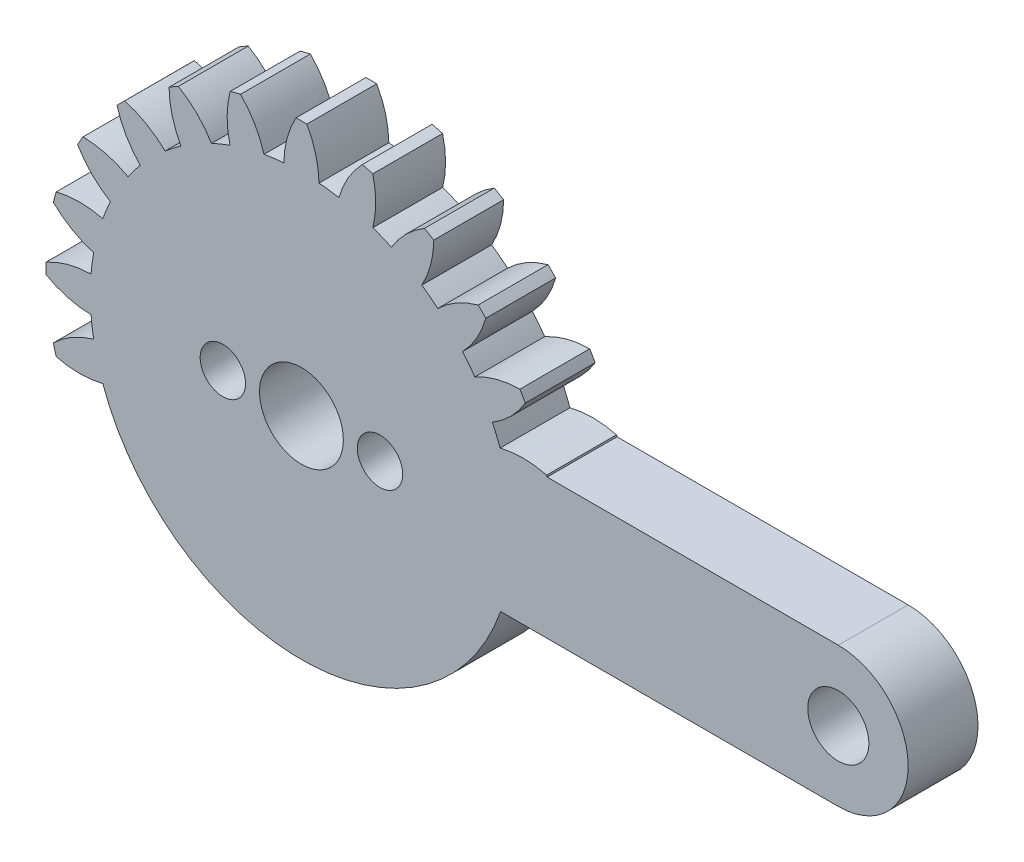
from build123d import *

# Parameters (mm, degrees)
SKETCH1_R           = 1.75
BOSS_EXTRUDE1_DEPTH = 4
SKETCH2_R           = 1.3
SKETCH2_R_2         = 2.4
CUT_EXTRUDE1_DEPTH  = 38.915688046


with BuildPart() as part:
    # Sketch1 → Boss-Extrude1 (new body)
    with BuildSketch(Plane.XY):
        with BuildLine():
            ThreePointArc((30.75, -4), (34.75, 0), (30.75, 4))
            Line((30.75, 4), (14.072558403, 4))
            ThreePointArc((14.072558403, 4), (14.06038767, 4.04257326), (14.048088143, 4.085109489))
            ThreePointArc((14.048088143, 4.085109489), (12.712915648, 4.255390909), (11.377106712, 4.090176385))
            ThreePointArc((11.377106712, 4.090176385), (11.169703548, 4.626642697), (10.937020765, 5.152637848))
            ThreePointArc((10.937020765, 5.152637848), (11.998404632, 5.980373095), (12.82210701, 7.044889767))
            ThreePointArc((12.82210701, 7.044889767), (12.669951657, 7.315), (12.51210701, 7.581825517))
            ThreePointArc((12.51210701, 7.581825517), (11.17835734, 7.400736668), (9.930825655, 6.8954189))
            ThreePointArc((9.930825655, 6.8954189), (9.591641884, 7.359925677), (9.230750012, 7.807775241))
            ThreePointArc((9.230750012, 7.807775241), (10.041734454, 8.882012453), (10.561852666, 10.123446462))
            ThreePointArc((10.561852666, 10.123446462), (10.344972209, 10.344972209), (10.123446462, 10.561852666))
            ThreePointArc((10.123446462, 10.561852666), (8.882012453, 10.041734454), (7.807775241, 9.230750012))
            ThreePointArc((7.807775241, 9.230750012), (7.359925677, 9.591641884), (6.8954189, 9.930825655))
            ThreePointArc((6.8954189, 9.930825655), (7.400736668, 11.17835734), (7.581825517, 12.51210701))
            ThreePointArc((7.581825517, 12.51210701), (7.315, 12.669951657), (7.044889767, 12.82210701))
            ThreePointArc((7.044889767, 12.82210701), (5.980373095, 11.998404632), (5.152637848, 10.937020765))
            ThreePointArc((5.152637848, 10.937020765), (4.626642697, 11.169703548), (4.090176385, 11.377106712))
            ThreePointArc((4.090176385, 11.377106712), (4.255390909, 12.712915648), (4.085109489, 14.048088143))
            ThreePointArc((4.085109489, 14.048088143), (3.78652263, 14.131494839), (3.486235477, 14.208555951))
            ThreePointArc((3.486235477, 14.208555951), (2.671181194, 13.137403362), (2.1463567, 11.897951627))
            ThreePointArc((2.1463567, 11.897951627), (1.578061664, 11.986568374), (1.00619511, 12.048056748))
            ThreePointArc((1.00619511, 12.048056748), (0.820047291, 13.381109763), (0.31, 14.626715284))
            ThreePointArc((0.31, 14.626715284), (0, 14.63), (-0.31, 14.626715284))
            ThreePointArc((-0.31, 14.626715284), (-0.820047291, 13.381109763), (-1.00619511, 12.048056748))
            ThreePointArc((-1.00619511, 12.048056748), (-1.578061664, 11.986568374), (-2.1463567, 11.897951627))
            ThreePointArc((-2.1463567, 11.897951627), (-2.671181194, 13.137403362), (-3.486235477, 14.208555951))
            ThreePointArc((-3.486235477, 14.208555951), (-3.78652263, 14.131494839), (-4.085109489, 14.048088143))
            ThreePointArc((-4.085109489, 14.048088143), (-4.255390909, 12.712915648), (-4.090176385, 11.377106712))
            ThreePointArc((-4.090176385, 11.377106712), (-4.626642697, 11.169703548), (-5.152637848, 10.937020765))
            ThreePointArc((-5.152637848, 10.937020765), (-5.980373095, 11.998404632), (-7.044889767, 12.82210701))
            ThreePointArc((-7.044889767, 12.82210701), (-7.315, 12.669951657), (-7.581825517, 12.51210701))
            ThreePointArc((-7.581825517, 12.51210701), (-7.400736668, 11.17835734), (-6.8954189, 9.930825655))
            ThreePointArc((-6.8954189, 9.930825655), (-7.359925677, 9.591641884), (-7.807775241, 9.230750012))
            ThreePointArc((-7.807775241, 9.230750012), (-8.882012453, 10.041734454), (-10.123446462, 10.561852666))
            ThreePointArc((-10.123446462, 10.561852666), (-10.344972209, 10.344972209), (-10.561852666, 10.123446462))
            ThreePointArc((-10.561852666, 10.123446462), (-10.041734454, 8.882012453), (-9.230750012, 7.807775241))
            ThreePointArc((-9.230750012, 7.807775241), (-9.591641884, 7.359925677), (-9.930825655, 6.8954189))
            ThreePointArc((-9.930825655, 6.8954189), (-11.17835734, 7.400736668), (-12.51210701, 7.581825517))
            ThreePointArc((-12.51210701, 7.581825517), (-12.669951657, 7.315), (-12.82210701, 7.044889767))
            ThreePointArc((-12.82210701, 7.044889767), (-11.998404632, 5.980373095), (-10.937020765, 5.152637848))
            ThreePointArc((-10.937020765, 5.152637848), (-11.169703548, 4.626642697), (-11.377106712, 4.090176385))
            ThreePointArc((-11.377106712, 4.090176385), (-12.712915648, 4.255390909), (-14.048088143, 4.085109489))
            ThreePointArc((-14.048088143, 4.085109489), (-14.131494839, 3.78652263), (-14.208555951, 3.486235477))
            ThreePointArc((-14.208555951, 3.486235477), (-13.137403362, 2.671181194), (-11.897951627, 2.1463567))
            ThreePointArc((-11.897951627, 2.1463567), (-11.986568374, 1.578061664), (-12.048056748, 1.00619511))
            ThreePointArc((-12.048056748, 1.00619511), (-13.381109763, 0.820047291), (-14.626715284, 0.31))
            ThreePointArc((-14.626715284, 0.31), (-14.63, 0), (-14.626715284, -0.31))
            ThreePointArc((-14.626715284, -0.31), (-13.381109763, -0.820047291), (-12.048056748, -1.00619511))
            ThreePointArc((-12.048056748, -1.00619511), (-11.986568374, -1.578061664), (-11.897951627, -2.1463567))
            ThreePointArc((-11.897951627, -2.1463567), (-13.137403362, -2.671181194), (-14.208555951, -3.486235477))
            ThreePointArc((-14.208555951, -3.486235477), (-14.131494839, -3.78652263), (-14.048088143, -4.085109489))
            ThreePointArc((-14.048088143, -4.085109489), (-12.712915648, -4.255390909), (-11.377106712, -4.090176385))
            ThreePointArc((-11.377106712, -4.090176385), (0.047845736, -12.089905326), (11.409123542, -4))
            Line((11.409123542, -4), (30.75, -4))
        make_face()
        Circle(SKETCH1_R, mode=Mode.SUBTRACT)
        with Locations((30.75, 0)):
            Circle(SKETCH1_R, mode=Mode.SUBTRACT)
    extrude(amount=BOSS_EXTRUDE1_DEPTH)

    # Sketch2 → Cut-Extrude1 (cut, through all)
    with BuildSketch(Plane.XY.offset(4)):
        with Locations((4.5, 0)):
            Circle(SKETCH2_R)
        with Locations((-4.5, 0)):
            Circle(SKETCH2_R)
        Circle(SKETCH2_R_2)
    extrude(amount=-CUT_EXTRUDE1_DEPTH, mode=Mode.SUBTRACT)


solid = part.part
